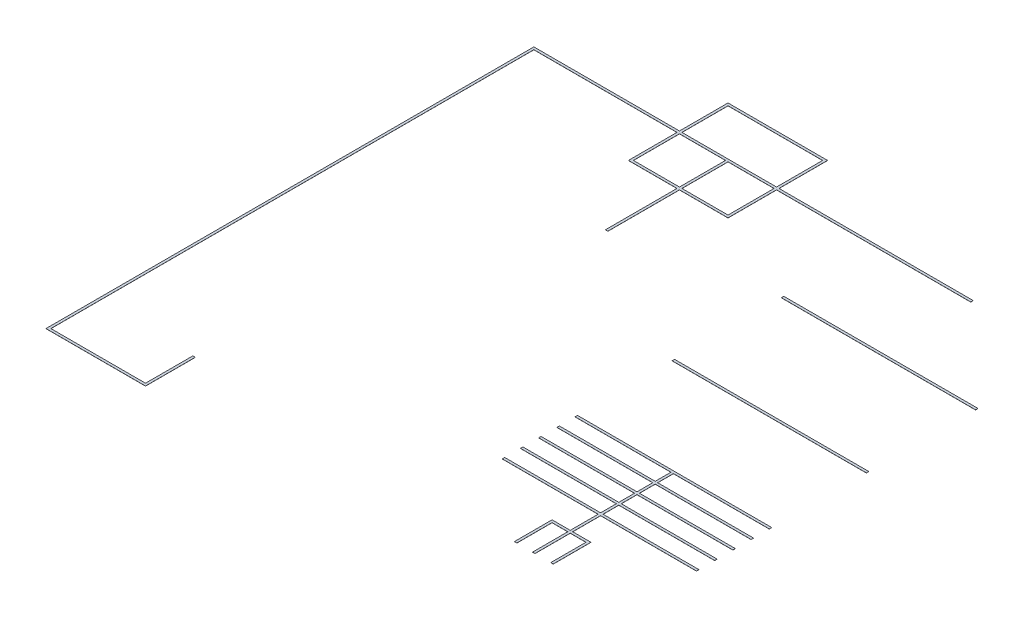
from build123d import *

# Parameters (mm, degrees)
SKETCH_2_W               = 780
SKETCH_2_H               = 380
SKETCH_2_W_2             = 380
EXTRUDE_1_DEPTH          = 1
CUT_EXTRUDE_2_DEPTH      = 3696.213364201
CUT_EXTRUDE_2_DEPTH_BACK = 3696.213364201
SKETCH_3_W               = 20
SKETCH_3_H               = 880
SKETCH_3_H_2             = 730
SKETCH_3_H_3             = 780


with BuildPart() as part:
    # 草图2 → 凸台-拉伸1 (new body)
    with BuildSketch(Plane(origin=(0, 0, 0), x_dir=(1, 0, 0), z_dir=(0, 1, 0))):
        Polygon((-2010.312352208, -1610), (-1190.312352208, -1610), (-1190.312352208, -1600), (-1190.312352208, -1200), (-1210.312352208, -1200), (-1210.312352208, -1590), (-1990.312352208, -1590), (-1990.312352208, 2390), (-810.312352208, 2390), (-810.312352208, 1990), (-410.312352208, 1990), (-410.312352208, 1400), (-390.312352208, 1400), (-390.312352208, 1990), (9.687647792, 1990), (9.687647792, 2390), (799.687647792, 2390), (1589.687647792, 2390), (1589.687647792, 1660), (799.687647792, 1660), (799.687647792, 1640), (1589.687647792, 1640), (1589.687647792, 760), (799.687647792, 760), (799.687647792, 740), (1589.687647792, 740), (1589.687647792, -40), (799.687647792, -40), (799.687647792, -60), (1589.687647792, -60), (1589.687647792, -190), (799.687647792, -190), (799.687647792, -210), (1589.687647792, -210), (1589.687647792, -340), (799.687647792, -340), (799.687647792, -360), (1589.687647792, -360), (1589.687647792, -490), (799.687647792, -490), (799.687647792, -510), (1589.687647792, -510), (1589.687647792, -640), (799.687647792, -640), (799.687647792, -660), (1589.687647792, -660), (1589.687647792, -890), (1439.687647792, -890), (1439.687647792, -1200), (1459.687647792, -1200), (1459.687647792, -910), (1589.687647792, -910), (1589.687647792, -1200), (1609.687647792, -1200), (1609.687647792, -910), (1739.687647792, -910), (1739.687647792, -1200), (1759.687647792, -1200), (1759.687647792, -890), (1609.687647792, -890), (1609.687647792, -660), (2399.687647792, -660), (2399.687647792, -640), (1609.687647792, -640), (1609.687647792, -510), (2399.687647792, -510), (2399.687647792, -490), (1609.687647792, -490), (1609.687647792, -360), (2399.687647792, -360), (2399.687647792, -340), (1609.687647792, -340), (1609.687647792, -210), (2399.687647792, -210), (2399.687647792, -190), (1609.687647792, -190), (1609.687647792, -60), (2399.687647792, -60), (2399.687647792, -40), (1609.687647792, -40), (1609.687647792, 740), (2399.687647792, 740), (2399.687647792, 760), (1609.687647792, 760), (1609.687647792, 1640), (2399.687647792, 1640), (2399.687647792, 1660), (1609.687647792, 1660), (1609.687647792, 2410), (799.687647792, 2410), (9.687647792, 2410), (9.687647792, 2810), (-810.312352208, 2810), (-810.312352208, 2410), (-2010.312352208, 2410), (-2010.312352208, -1600), align=None)
        with Locations((-400.312352208, 2600)):
            Rectangle(SKETCH_2_W, SKETCH_2_H, mode=Mode.SUBTRACT)
        with Locations((-200.312352208, 2200)):
            Rectangle(SKETCH_2_W_2, SKETCH_2_H, mode=Mode.SUBTRACT)
        with Locations((-600.312352208, 2200)):
            Rectangle(SKETCH_2_W_2, SKETCH_2_H, mode=Mode.SUBTRACT)
    extrude(amount=EXTRUDE_1_DEPTH)

    # 草图3 → 切除-拉伸2 (cut, two sides: drawn at the far end of the back side and taken through both)
    with BuildSketch(Plane(origin=(0, 0, 0), x_dir=(1, 0, 0), z_dir=(0, 1, 0)).offset(-CUT_EXTRUDE_2_DEPTH_BACK)):
        with Locations((1599.687647792, 1200)):
            Rectangle(SKETCH_3_W, SKETCH_3_H)
        with Locations((1599.687647792, 2025)):
            Rectangle(SKETCH_3_W, SKETCH_3_H_2)
        with Locations((1599.687647792, 350)):
            Rectangle(SKETCH_3_W, SKETCH_3_H_3)
    extrude(amount=CUT_EXTRUDE_2_DEPTH + CUT_EXTRUDE_2_DEPTH_BACK, mode=Mode.SUBTRACT)


with BuildPart() as cut_extrude_2_piece_1:
    # of the separate pieces the step leaves, piece 1, a body of its own (cut_extrude_2_pieces)
    add(part.part.solids().sort_by_distance((-2010.312352208, 0, 1610))[0])


with BuildPart() as cut_extrude_2_piece_2:
    # of the separate pieces the step leaves, piece 2, a body of its own (cut_extrude_2_pieces)
    add(part.part.solids().sort_by_distance((2399.687647792, 0, 60))[0])


with BuildPart() as cut_extrude_2_piece_3:
    # of the separate pieces the step leaves, piece 3, a body of its own (cut_extrude_2_pieces)
    add(part.part.solids().sort_by_distance((2399.687647792, 0, -740))[0])


with BuildPart() as cut_extrude_2_piece_4:
    # of the separate pieces the step leaves, piece 4, a body of its own (cut_extrude_2_pieces)
    add(part.part.solids().sort_by_distance((2399.687647792, 0, -1640))[0])


solid = Compound([cut_extrude_2_piece_1.part, cut_extrude_2_piece_2.part, cut_extrude_2_piece_3.part, cut_extrude_2_piece_4.part])
